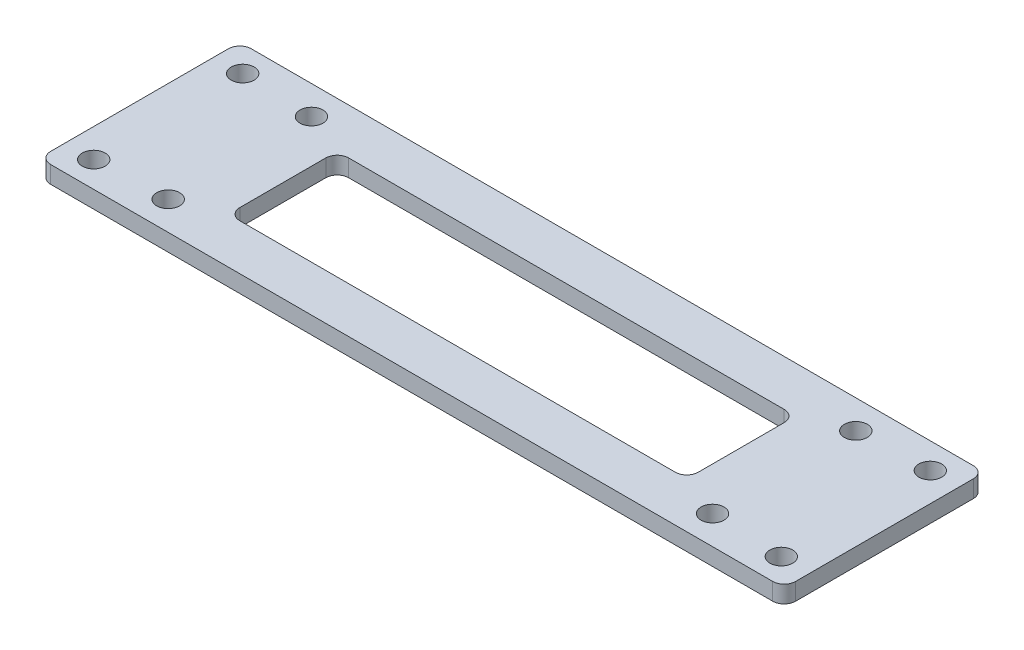
from build123d import *

# Parameters (mm, degrees)
SKETCH_1_W          = 110
SKETCH_1_H          = 35
SKETCH_1_R          = 2
EXTRUDE_1_DEPTH     = 3
SKETCH_2_W          = 10
SKETCH_2_H          = 35
SKETCH_2_R          = 2
EXTRUDE_2_DEPTH     = 3
SKETCH_3_W          = 80
SKETCH_3_H          = 19
CUT_EXTRUDE_1_DEPTH = 3
FILLET_1_R          = 2


with BuildPart() as part:
    # 草图1 → 凸台-拉伸1 (new body)
    with BuildSketch(Plane(origin=(0, 0, 0), x_dir=(1, 0, 0), z_dir=(0, 1, 0))):
        Rectangle(SKETCH_1_W, SKETCH_1_H)
        with Locations(Location((-47.5, 12.5, 0), (0, 0, 270))):
            Circle(SKETCH_1_R, mode=Mode.SUBTRACT)
        with Locations(Location((-47.5, -12.5, 0), (0, 0, 270))):
            Circle(SKETCH_1_R, mode=Mode.SUBTRACT)
        with Locations(Location((47.5, -12.5, 0), (0, 0, 90))):
            Circle(SKETCH_1_R, mode=Mode.SUBTRACT)
        with Locations(Location((47.5, 12.5, 0), (0, 0, 90))):
            Circle(SKETCH_1_R, mode=Mode.SUBTRACT)
    extrude(amount=EXTRUDE_1_DEPTH)

    # 草图2 → 凸台-拉伸2 (add)
    # profile 1 of 2: a face of its own
    with BuildSketch(Plane(origin=(0, 3, 0), x_dir=(1, 0, 0), z_dir=(0, 1, 0))):
        with Locations((60, 0)):
            Rectangle(SKETCH_2_W, SKETCH_2_H)
        with Locations(Location((60, 13, 0), (0, 0, 270))):
            Circle(SKETCH_2_R, mode=Mode.SUBTRACT)
        with Locations(Location((60, -13, 0), (0, 0, 270))):
            Circle(SKETCH_2_R, mode=Mode.SUBTRACT)
    # profile 2 of 2: a face of its own
    with BuildSketch(Plane(origin=(0, 3, 0), x_dir=(1, 0, 0), z_dir=(0, 1, 0))):
        with Locations((-60, 0)):
            Rectangle(SKETCH_2_W, SKETCH_2_H)
        with Locations(Location((-60, 13, 0), (0, 0, 270))):
            Circle(SKETCH_2_R, mode=Mode.SUBTRACT)
        with Locations(Location((-60, -13, 0), (0, 0, 270))):
            Circle(SKETCH_2_R, mode=Mode.SUBTRACT)
    extrude(amount=-EXTRUDE_2_DEPTH)

    # 草图3 → 切除-拉伸1 (cut)
    with BuildSketch(Plane(origin=(0, 3, 0), x_dir=(1, 0, 0), z_dir=(0, 1, 0))):
        Rectangle(SKETCH_3_W, SKETCH_3_H)
    extrude(amount=-CUT_EXTRUDE_1_DEPTH, mode=Mode.SUBTRACT)

    # 圆角1
    fillet_1_edges = [part.edges().sort_by_distance(p)[0] for p in [
        (-65, 1.5, -17.5),
        (-65, 1.5, 17.5),
        (65, 1.5, -17.5),
        (65, 1.5, 17.5),
        (40, 1.5, -9.5),
        (40, 1.5, 9.5),
        (-40, 1.5, 9.5),
        (-40, 1.5, -9.5),
    ]]
    fillet(fillet_1_edges, radius=FILLET_1_R)


solid = part.part
